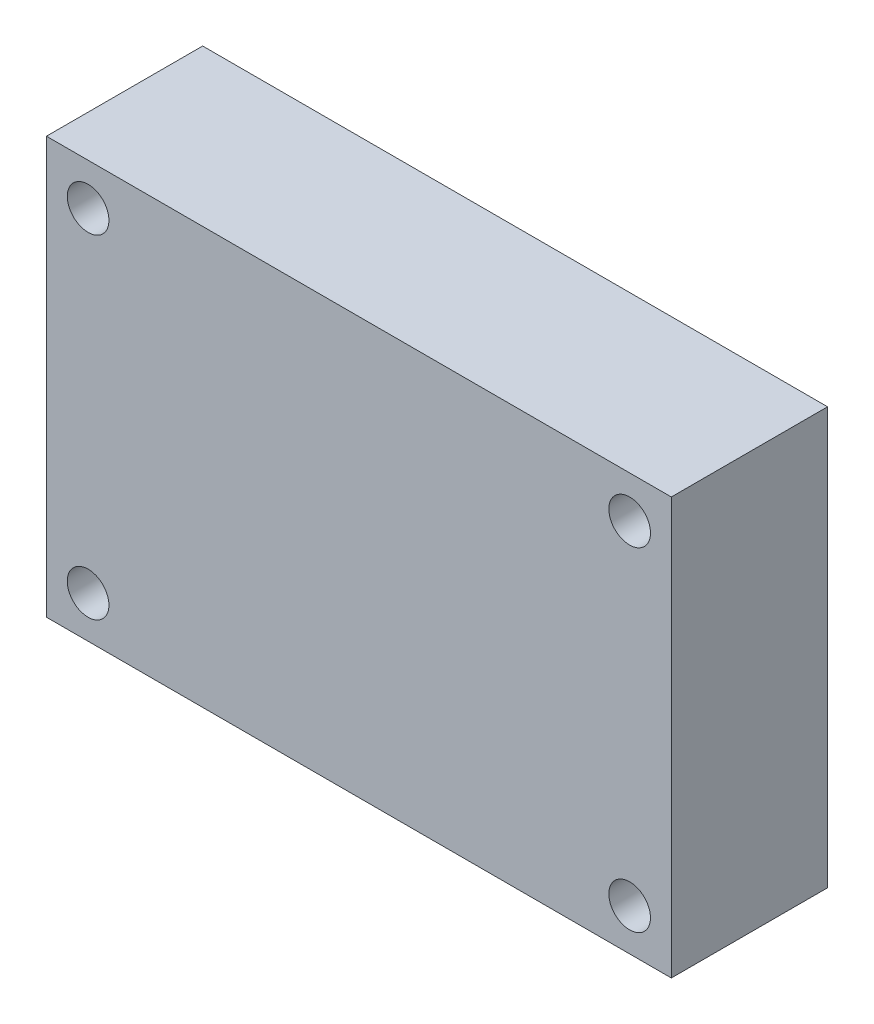
from build123d import *

# Parameters (mm, degrees)
ESQUISSE1_W             = 60
ESQUISSE1_H             = 40
BOSS_EXTRU_1_DEPTH      = 15
ESQUISSE3_R             = 2
ENL_V_MAT_EXTRU_1_DEPTH = 25
ENL_V_MAT_EXTRU_2_DEPTH = 10
CONG_1_R                = 1


with BuildPart() as part:
    # Esquisse1 → Boss.-Extru.1 (new body)
    with BuildSketch(Plane.XY):
        Rectangle(ESQUISSE1_W, ESQUISSE1_H)
    extrude(amount=BOSS_EXTRU_1_DEPTH)

    # Esquisse3 → Enlèv. mat.-Extru.1 (cut)
    with BuildSketch(Plane(origin=(0, 0, 0), x_dir=(-1, 0, 0), z_dir=(0, 0, -1))):
        with Locations((-26, 16)):
            Circle(ESQUISSE3_R)
        with Locations((26, 16)):
            Circle(ESQUISSE3_R)
        with Locations((-26, -16)):
            Circle(ESQUISSE3_R)
        with Locations((26, -16)):
            Circle(ESQUISSE3_R)
    extrude(amount=-ENL_V_MAT_EXTRU_1_DEPTH, mode=Mode.SUBTRACT)

    # Esquisse4 → Enlèv. mat.-Extru.2 (cut)
    with BuildSketch(Plane(origin=(0, 0, 0), x_dir=(-1, 0, 0), z_dir=(0, 0, -1))):
        with BuildLine():
            ThreePointArc((18.333200892, 8.584679084), (-4.652870853, 13.070183937), (-22.581024868, -1.998344249))
            ThreePointArc((-22.581024868, -1.998344249), (-18.601997418, -12.58925264), (-8.011089026, -8.61022519))
            ThreePointArc((-8.011089026, -8.61022519), (-0.646121832, -2.420005289), (8.796660967, -4.26267108))
            ThreePointArc((8.796660967, -4.26267108), (19.988606012, -2.607265961), (18.333200892, 8.584679084))
        make_face()
    extrude(amount=-ENL_V_MAT_EXTRU_2_DEPTH, mode=Mode.SUBTRACT)

    # Congé1
    cong_1_edges = [part.edges().sort_by_distance(p)[0] for p in [
        (-19.988606012, -2.607265961, 10),
        (0.646121832, -2.420005289, 10),
        (18.601997418, -12.58925264, 10),
        (4.652870853, 13.070183937, 10),
    ]]
    fillet(cong_1_edges, radius=CONG_1_R)


solid = part.part
